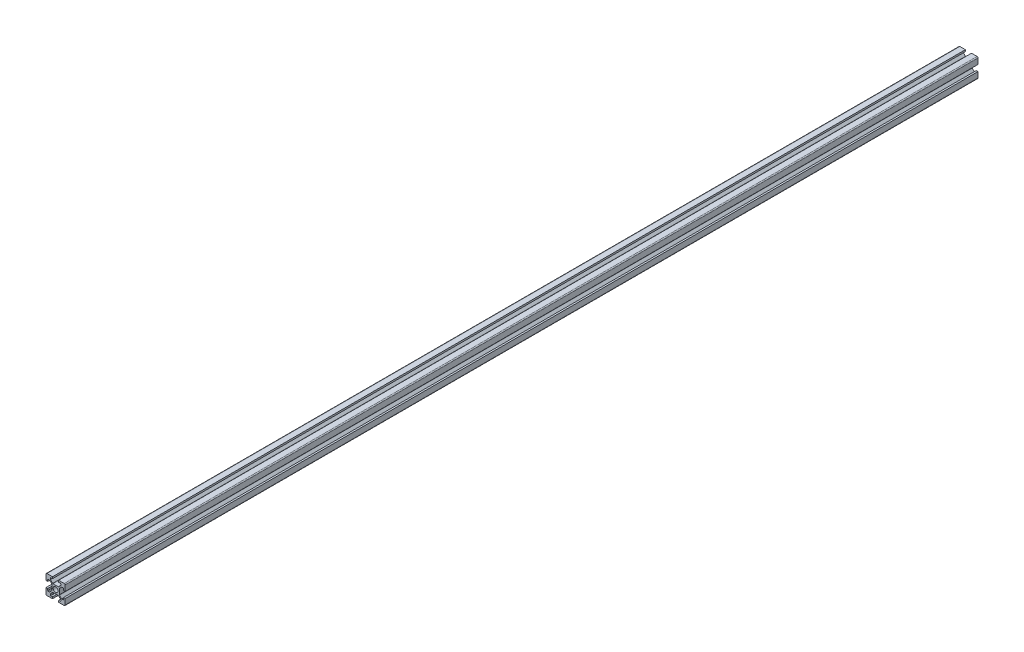
from build123d import *

# Parameters (mm, degrees)
SKETCH1_R           = 2.5
BOSS_EXTRUDE1_DEPTH = 955
FILLET1_R           = 1
FILLET2_R           = 0.5
FILLET3_R           = 0.5
FILLET4_R           = 0.5
FILLET5_R           = 0.5


with BuildPart() as part:
    # Sketch1 → Boss-Extrude1 (new body)
    with BuildSketch(Plane.XY):
        Polygon((13.2, 0), (13.2, 1.8), (15.45, 1.8), (15.45, 3.6), (12.95, 6.1), (7.05, 6.1), (4.55, 3.6), (4.55, 1.8), (6.8, 1.8), (6.8, 0), (0, 0), (0, 6.8), (1.8, 6.8), (1.8, 4.55), (3.6, 4.55), (6.1, 7.05), (6.1, 12.95), (3.6, 15.45), (1.8, 15.45), (1.8, 13.2), (0, 13.2), (0, 20), (6.8, 20), (6.8, 18.2), (4.55, 18.2), (4.55, 16.4), (7.05, 13.9), (12.95, 13.9), (15.45, 16.4), (15.45, 18.2), (13.2, 18.2), (13.2, 20), (20, 20), (20, 13.2), (18.2, 13.2), (18.2, 15.45), (16.4, 15.45), (13.9, 12.95), (13.9, 7.05), (16.4, 4.55), (18.2, 4.55), (18.2, 6.8), (20, 6.8), (20, 0), align=None)
        with Locations((10, 10)):
            Circle(SKETCH1_R, mode=Mode.SUBTRACT)
    extrude(amount=BOSS_EXTRUDE1_DEPTH)

    # Fillet1
    fillet1_edges = [part.edges().sort_by_distance(p)[0] for p in [
        (0, 0, 477.5),
        (0, 20, 477.5),
        (20, 20, 477.5),
        (20, 0, 477.5),
    ]]
    fillet(fillet1_edges, radius=FILLET1_R)

    # Fillet2
    fillet2_edges = [part.edges().sort_by_distance(p)[0] for p in [
        (4.55, 18.2, 477.5),
        (4.55, 16.4, 477.5),
        (7.05, 13.9, 477.5),
        (12.95, 13.9, 477.5),
        (15.45, 16.4, 477.5),
        (15.45, 18.2, 477.5),
    ]]
    fillet(fillet2_edges, radius=FILLET2_R)

    # Fillet3
    fillet3_edges = [part.edges().sort_by_distance(p)[0] for p in [
        (18.2, 15.45, 477.5),
        (16.4, 15.45, 477.5),
        (13.9, 12.95, 477.5),
        (13.9, 7.05, 477.5),
        (16.4, 4.55, 477.5),
        (18.2, 4.55, 477.5),
    ]]
    fillet(fillet3_edges, radius=FILLET3_R)

    # Fillet4
    fillet4_edges = [part.edges().sort_by_distance(p)[0] for p in [
        (1.8, 4.55, 477.5),
        (3.6, 4.55, 477.5),
        (6.1, 7.05, 477.5),
        (6.1, 12.95, 477.5),
        (3.6, 15.45, 477.5),
        (1.8, 15.45, 477.5),
    ]]
    fillet(fillet4_edges, radius=FILLET4_R)

    # Fillet5
    fillet5_edges = [part.edges().sort_by_distance(p)[0] for p in [
        (15.45, 1.8, 477.5),
        (15.45, 3.6, 477.5),
        (12.95, 6.1, 477.5),
        (7.05, 6.1, 477.5),
        (4.55, 3.6, 477.5),
        (4.55, 1.8, 477.5),
    ]]
    fillet(fillet5_edges, radius=FILLET5_R)


solid = part.part
